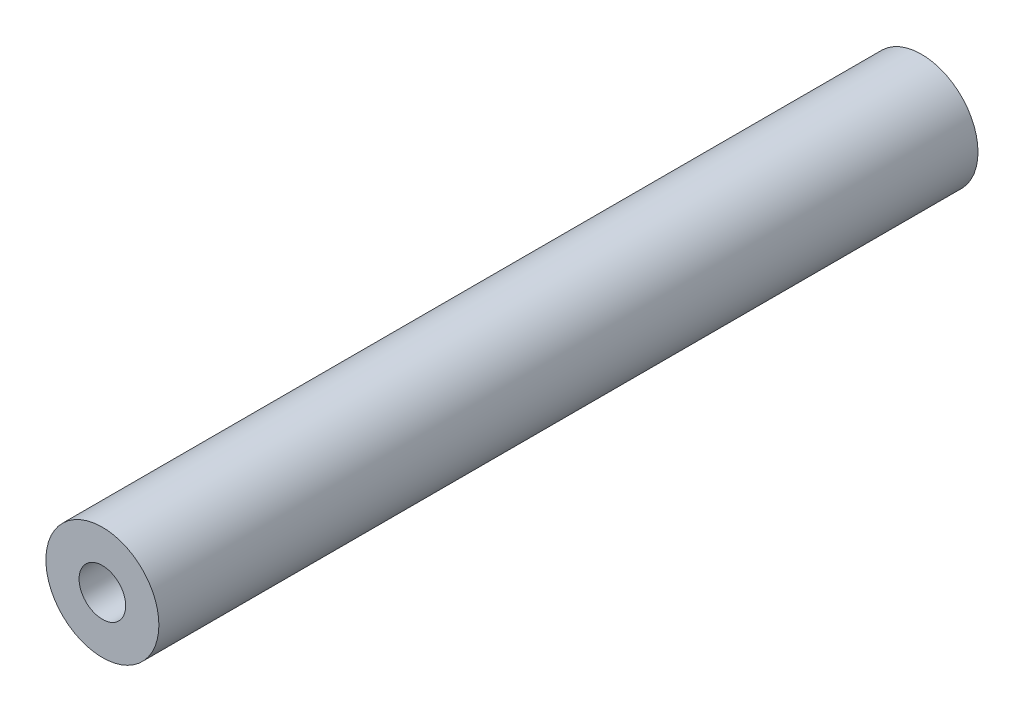
from build123d import *


with BuildPart() as part:
    # Esquisse1 → Révolution1 (revolve)
    with BuildSketch(Plane(origin=(0, 0, 0), x_dir=(1, 0, 0), z_dir=(0, 1, 0))):
        Polygon((1.65, -17.4), (0, -17.4), (0, -40.6), (1.65, -40.6), (1.65, -58), (4, -58), (4, 0), (1.65, 0), align=None)
    revolve(axis=Axis((0, 0, 0), (0, 0, 1)))


solid = part.part
